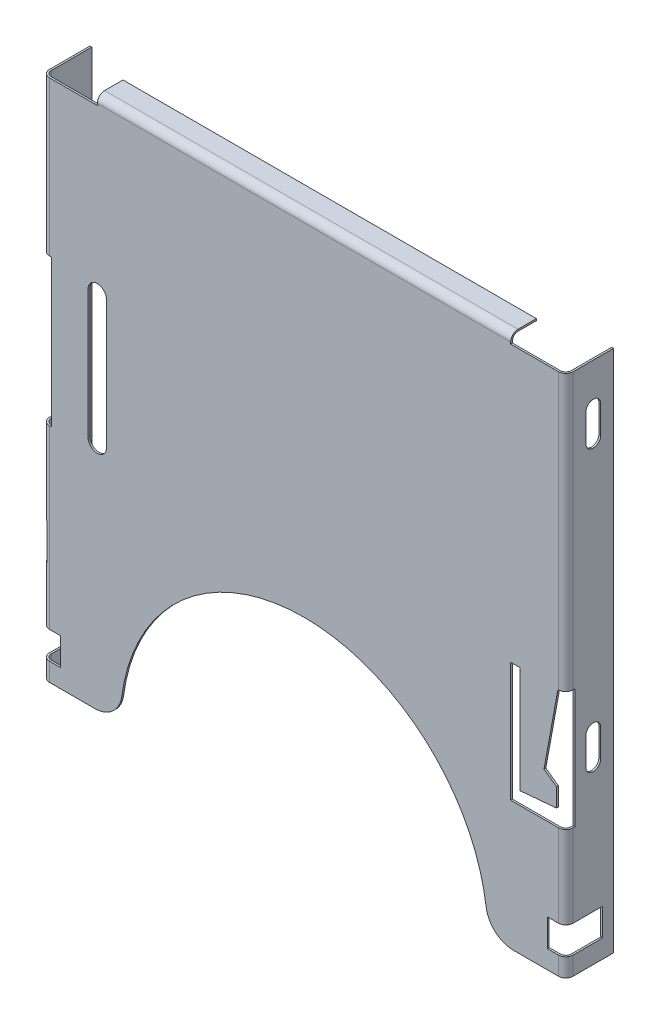
from build123d import *

# Parameters (mm, degrees)
RESSALTO_EXTRUS_O1_DEPTH = 2.6
FILETE1_R                = 0.4
CASCA1_T                 = -0.1
CORTE_EXTRUS_O1_DEPTH    = 12.6
ESBO_O3_W                = 1
ESBO_O3_H                = 1.5
ESBO_O3_W_2              = 0.2
ESBO_O3_H_2              = 2
ESBO_O3_W_3              = 3
ESBO_O3_H_3              = 0.5
CORTE_EXTRUS_O2_DEPTH    = 0.5
CORTE_EXTRUS_O3_DEPTH    = 0.5
ESBO_O5_W                = 1.6
ESBO_O5_H                = 1.5
CORTE_EXTRUS_O6_DEPTH    = 33.082082227
ESBO_O6_W                = 0.7
ESBO_O6_H                = 2
CORTE_EXTRUS_O7_DEPTH    = 0.5


with BuildPart() as part:
    # Esboço1 → Ressalto-extrusão1 (new body)
    with BuildSketch(Plane.XY):
        with BuildLine():
            Line((-14.25, -14.5), (-11.401754251, -14.5))
            ThreePointArc((-11.401754251, -14.5), (-10.412683541, -14.127714117), (-9.914568914, -13.195652174))
            ThreePointArc((-9.914568914, -13.195652174), (0, -4.5), (9.914568914, -13.195652174))
            ThreePointArc((9.914568914, -13.195652174), (10.412683541, -14.127714117), (11.401754251, -14.5))
            Line((11.401754251, -14.5), (14.25, -14.5))
            Line((14.25, -14.5), (14.25, 14.5))
            Line((14.25, 14.5), (-14.25, 14.5))
            Line((-14.25, 14.5), (-14.25, -14.5))
        make_face()
    extrude(amount=RESSALTO_EXTRUS_O1_DEPTH)

    # Filete1
    filete1_edges = [part.edges().sort_by_distance(p)[0] for p in [
        (-14.25, 0, 2.6),
        (14.25, 0, 2.6),
        (0, 14.5, 2.6),
    ]]
    fillet(filete1_edges, radius=FILETE1_R)

    # Casca1
    casca1_openings = [part.faces().sort_by_distance(p)[0] for p in [
        (0, 2.425973119, 0),
    ]]
    offset(amount=CASCA1_T, openings=casca1_openings)

    # Esboço2 → Corte-extrusão1 (cut)
    with BuildSketch(Plane.XZ.offset(14.5)):
        with BuildLine():
            Line((-14.15, 0), (14.15, 0))
            Line((14.15, 0), (14.15, 2.2))
            ThreePointArc((14.15, 2.2), (14.062132034, 2.412132034), (13.85, 2.5))
            Line((13.85, 2.5), (-13.85, 2.5))
            ThreePointArc((-13.85, 2.5), (-14.062132034, 2.412132034), (-14.15, 2.2))
            Line((-14.15, 2.2), (-14.15, 0))
        make_face()
    extrude(amount=-CORTE_EXTRUS_O1_DEPTH, mode=Mode.SUBTRACT)

    # Esboço3 → Corte-extrusão2 (cut)
    with BuildSketch(Plane.XY.offset(2.6)):
        with BuildLine():
            Line((-10.75, 5.1), (-10.75, -1.9))
            ThreePointArc((-10.75, -1.9), (-11.25, -2.4), (-11.75, -1.9))
            Line((-11.75, -1.9), (-11.75, 5.1))
            ThreePointArc((-11.75, 5.1), (-11.25, 5.6), (-10.75, 5.1))
        make_face()
        Polygon((11.25, -1), (11.25, -7.5), (14.25, -7.5), (14.25, -1), (13.821156639, -1), (13.065956143, -5.125022673), (13.75, -5.625022673), (13.75, -6.625022673), (11.75, -6.8), (11.75, -1), align=None)
        with Locations((13.75, -12.75)):
            Rectangle(ESBO_O3_W, ESBO_O3_H)
        with Locations((-13.75, -12.75)):
            Rectangle(ESBO_O3_W, ESBO_O3_H)
        with Locations((-14.15, -8)):
            Rectangle(ESBO_O3_W_2, ESBO_O3_H_2)
        with Locations((12.75, 14.25)):
            Rectangle(ESBO_O3_W_3, ESBO_O3_H_3)
        with Locations((-12.75, 14.25)):
            Rectangle(ESBO_O3_W_3, ESBO_O3_H_3)
    extrude(amount=-CORTE_EXTRUS_O2_DEPTH, mode=Mode.SUBTRACT)

    # Esboço4 → Corte-extrusão3 (cut)
    with BuildSketch(Plane(origin=(0, 14.5, 0), x_dir=(1, 0, 0), z_dir=(0, 1, 0))):
        Polygon((-11.25, -2.4), (-11.25, -1.2), (11.25, -1.2), (11.25, -2.2), (14.25, -2.2), (14.25, 0), (-14.25, 0), (-14.25, -2.4), align=None)
    extrude(amount=-CORTE_EXTRUS_O3_DEPTH, mode=Mode.SUBTRACT)

    # Esboço5 → Corte-extrusão6 (cut, through all)
    with BuildSketch(Plane(origin=(14.25, 0, 0), x_dir=(0, 0, -1), z_dir=(1, 0, 0))):
        with Locations((-1.4, -12.75)):
            Rectangle(ESBO_O5_W, ESBO_O5_H)
        with BuildLine():
            Line((-1.5, -5), (-1.5, -3.5))
            ThreePointArc((-1.5, -3.5), (-1.1, -3.1), (-0.7, -3.5))
            Line((-0.7, -3.5), (-0.7, -5))
            ThreePointArc((-0.7, -5), (-1.1, -5.4), (-1.5, -5))
        make_face()
        with BuildLine():
            Line((-1.5, 10.25), (-1.5, 11.75))
            ThreePointArc((-1.5, 11.75), (-1.1, 12.15), (-0.7, 11.75))
            Line((-0.7, 11.75), (-0.7, 10.25))
            ThreePointArc((-0.7, 10.25), (-1.1, 9.85), (-1.5, 10.25))
        make_face()
    extrude(amount=-CORTE_EXTRUS_O6_DEPTH, mode=Mode.SUBTRACT)

    # Esboço6 → Corte-extrusão7 (cut)
    with BuildSketch(Plane.ZY.offset(14.25)):
        Polygon((1.1, 5.6), (0.6, 5.6), (0.6, -2.4), (2.6, -2.4), (2.6, 5.6), (2.1, 5.6), (2.1, -1.9), (1.1, -1.9), align=None)
        with Locations((1.85, -8)):
            Rectangle(ESBO_O6_W, ESBO_O6_H)
    extrude(amount=-CORTE_EXTRUS_O7_DEPTH, mode=Mode.SUBTRACT)


solid = part.part
